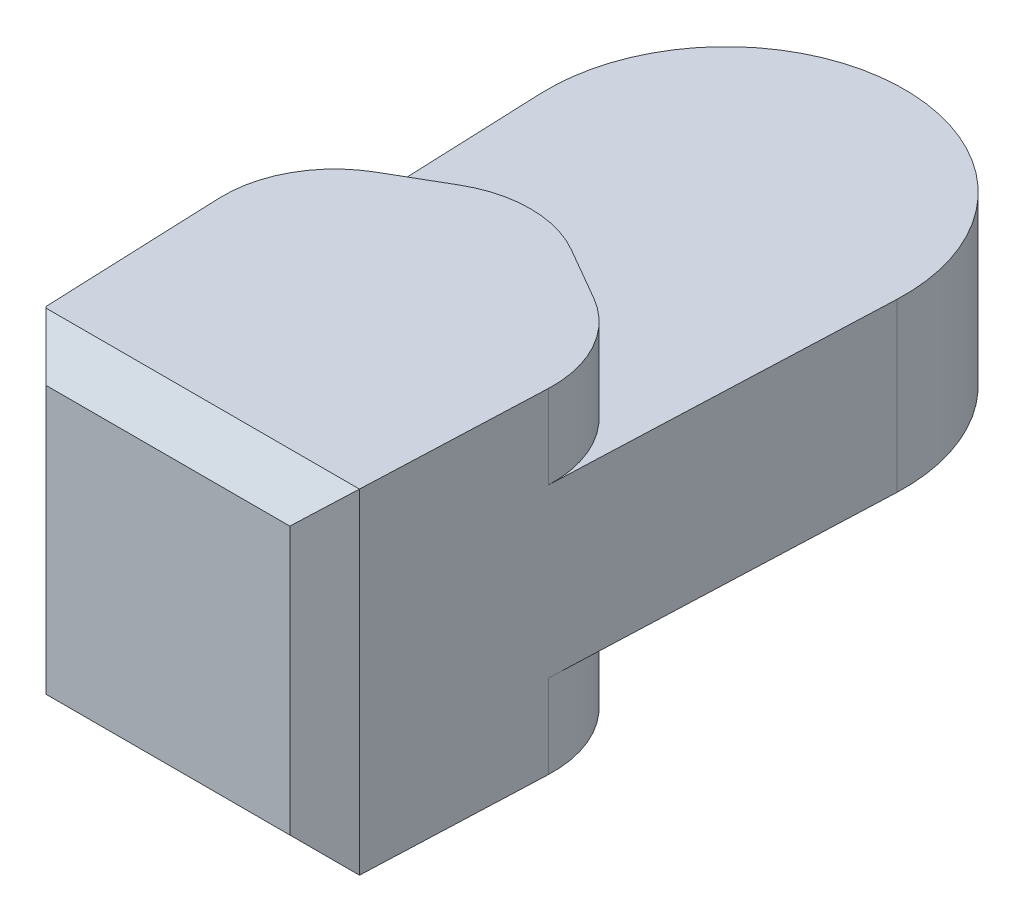
from build123d import *
from OCP.BRepFilletAPI import BRepFilletAPI_MakeChamfer

# Parameters (mm, degrees)
BOSS_EXTRUDE1_DEPTH      = 1.5
BOSS_EXTRUDE1_DEPTH_BACK = 1.5
SKETCH1_R                = 1.6
CUT_EXTRUDE1_DEPTH       = 0.75
CUT_EXTRUDE2_DEPTH       = 0.75
FILLET1_R                = 1
CHAMFER1_SIZE            = 0.3
CHAMFER1_SIZE2           = 0.312837622


with BuildPart() as part:
    # Sketch1 → Boss-Extrude1 (new, two sides: drawn at the far end of the back side and taken through both)
    with BuildSketch(Plane(origin=(0, 0, 0), x_dir=(1, 0, 0), z_dir=(0, 1, 0)).offset(-BOSS_EXTRUDE1_DEPTH_BACK)):
        with BuildLine():
            ThreePointArc((1.59870493, 2.43563738), (0, 0.9), (-1.59870493, 2.43563738))
            Line((-1.59870493, 2.43563738), (-1.4, -2.5))
            Line((-1.4, -2.5), (1.4, -2.5))
            Line((1.4, -2.5), (1.59870493, 2.43563738))
        make_face()
        with Locations((0, 2.5)):
            Circle(SKETCH1_R)
    extrude(amount=BOSS_EXTRUDE1_DEPTH + BOSS_EXTRUDE1_DEPTH_BACK)

    # Sketch2 → Cut-Extrude1 (cut)
    with BuildSketch(Plane.XZ.offset(1.5)):
        Polygon((0, -0.9), (2.885753251, 0.766090416), (2.885753251, -2.050590863), (2.110091131, -4.50528075), (-1.600263029, -4.441671147), (-3.669548881, -0.857562917), (-3.144856004, 0.915683461), align=None)
    extrude(amount=-CUT_EXTRUDE1_DEPTH, mode=Mode.SUBTRACT)

    # Sketch3 → Cut-Extrude2 (cut)
    with BuildSketch(Plane(origin=(0, 1.5, 0), x_dir=(1, 0, 0), z_dir=(0, 1, 0))):
        Polygon((0, 0.9), (2.885753251, -0.766090416), (2.885753251, 2.050590863), (2.110091131, 4.50528075), (-1.600263029, 4.441671147), (-3.669548881, 0.857562917), (-3.144856004, -0.915683461), align=None)
    extrude(amount=-CUT_EXTRUDE2_DEPTH, mode=Mode.SUBTRACT)

    # Fillet1
    fillet1_edges = [part.edges().sort_by_distance(p)[0] for p in [
        (-1.501970059, -1.125, -0.032837182),
        (1.501970059, -1.125, -0.032837182),
        (0, -1.125, -0.9),
        (-1.501970059, 1.125, -0.032837182),
        (1.501970059, 1.125, -0.032837182),
        (0, 1.125, -0.9),
    ]]
    fillet(fillet1_edges, radius=FILLET1_R)

    # Chamfer1: one chamfer whose edges measure the first distance from different faces: ONE call of the kernel's chamfer builder (chamfer() names one face for all edges)
    chamfer1_edges_1 = [part.edges().sort_by_distance(p)[0] for p in [
        (0, 1.5, 2.5),
        (0, -1.5, 2.5),
    ]]
    chamfer1_edges_2 = [part.edges().sort_by_distance(p)[0] for p in [
        (1.4, 0, 2.5),
    ]]
    chamfer1_side_2 = [part.faces().sort_by_distance(p)[0] for p in [
        (1.482345448, 0, 0.454619096),
    ]]
    chamfer1_edges_3 = [part.edges().sort_by_distance(p)[0] for p in [
        (-1.4, 0, 2.5),
    ]]
    chamfer1_side_3 = [part.faces().sort_by_distance(p)[0] for p in [
        (0, 0, 2.5),
    ]]
    chamfer1 = BRepFilletAPI_MakeChamfer(part.part.solid().wrapped)
    for e in chamfer1_edges_1:
        chamfer1.Add(CHAMFER1_SIZE, e.wrapped)
    for e in chamfer1_edges_2:
        chamfer1.Add(CHAMFER1_SIZE, CHAMFER1_SIZE2, e.wrapped, chamfer1_side_2[0].wrapped)  # the first distance lies on this face
    for e in chamfer1_edges_3:
        chamfer1.Add(CHAMFER1_SIZE, CHAMFER1_SIZE2, e.wrapped, chamfer1_side_3[0].wrapped)  # the first distance lies on this face
    add(Compound.cast(chamfer1.Shape()), mode=Mode.REPLACE)


solid = part.part
